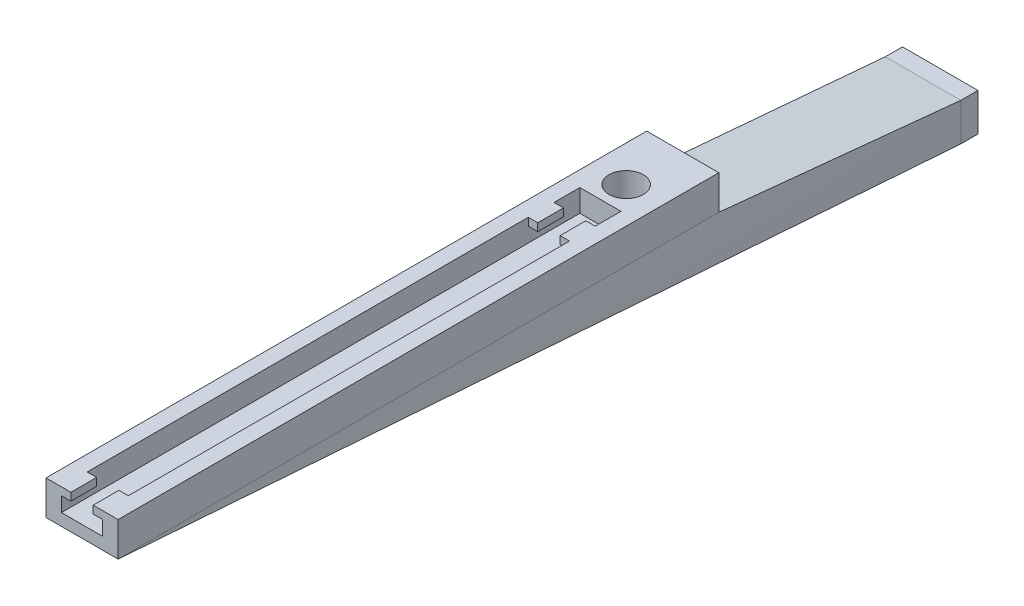
from build123d import *

# Parameters (mm, degrees)
SKETCH1_W           = 11
SKETCH1_H           = 22
BOSS_EXTRUDE1_DEPTH = 5
SKETCH3_W           = 21
SKETCH3_H           = 175
BOSS_EXTRUDE2_DEPTH = 10
CUT_EXTRUDE1_DEPTH  = 151
SKETCH5_R           = 5
CUT_EXTRUDE2_DEPTH  = 15
CUT_EXTRUDE3_START  = -2.25
SKETCH6_W           = 12
SKETCH6_H           = 128.5
SKETCH6_H_2         = 7.5
CUT_EXTRUDE3_DEPTH  = 2.25


with BuildPart() as part:
    # Sketch1 → Boss-Extrude1 (new body)
    with BuildSketch(Plane(origin=(0, 0, 0), x_dir=(0, 1, 0), z_dir=(0, 0, 1))):
        Rectangle(SKETCH1_W, SKETCH1_H)
    extrude(amount=BOSS_EXTRUDE1_DEPTH)


with BuildPart() as body_2:
    # Sketch3 → Boss-Extrude2 (new body)
    with BuildSketch(Plane(origin=(0, 22, 0), x_dir=(-1, 0, 0), z_dir=(0, 1, 0))):
        with Locations((0, 162.5)):
            Rectangle(SKETCH3_W, SKETCH3_H)
    extrude(amount=-BOSS_EXTRUDE2_DEPTH)


    add(part.part)  # loft1 joins it to this body
    # loft from a face of the part (loft1)
    loft([body_2.faces().sort_by_distance((0, 12, 162.5))[0], body_2.faces().sort_by_distance((0, 0, 5))[0]])

    # Sketch4 → Cut-Extrude1 (cut)
    with BuildSketch(Plane.XY.offset(250)):
        Polygon((-3.25, 22), (-3.25, 19.75), (-6, 19.75), (-6, 15.5), (6, 15.5), (6, 19.75), (3.25, 19.75), (3.25, 22), align=None)
    extrude(amount=-CUT_EXTRUDE1_DEPTH, mode=Mode.SUBTRACT)

    # Sketch5 → Cut-Extrude2 (cut)
    with BuildSketch(Plane(origin=(0, 22, 0), x_dir=(-1, 0, 0), z_dir=(0, 1, 0))):
        with Locations(Location((0, 91.5, 0), (0, 0, 90))):
            Circle(SKETCH5_R)
    extrude(amount=-CUT_EXTRUDE2_DEPTH, mode=Mode.SUBTRACT)

    # Sketch6 → Cut-Extrude3 (cut)
    with BuildSketch(Plane(origin=(0, 22, 0), x_dir=(-1, 0, 0), z_dir=(0, 1, 0)).offset(CUT_EXTRUDE3_START)):
        with Locations((0, 178.25)):
            Rectangle(SKETCH6_W, SKETCH6_H)
        with Locations((0, 102.75)):
            Rectangle(SKETCH6_W, SKETCH6_H_2)
    extrude(amount=CUT_EXTRUDE3_DEPTH, mode=Mode.SUBTRACT)


solid = body_2.part
